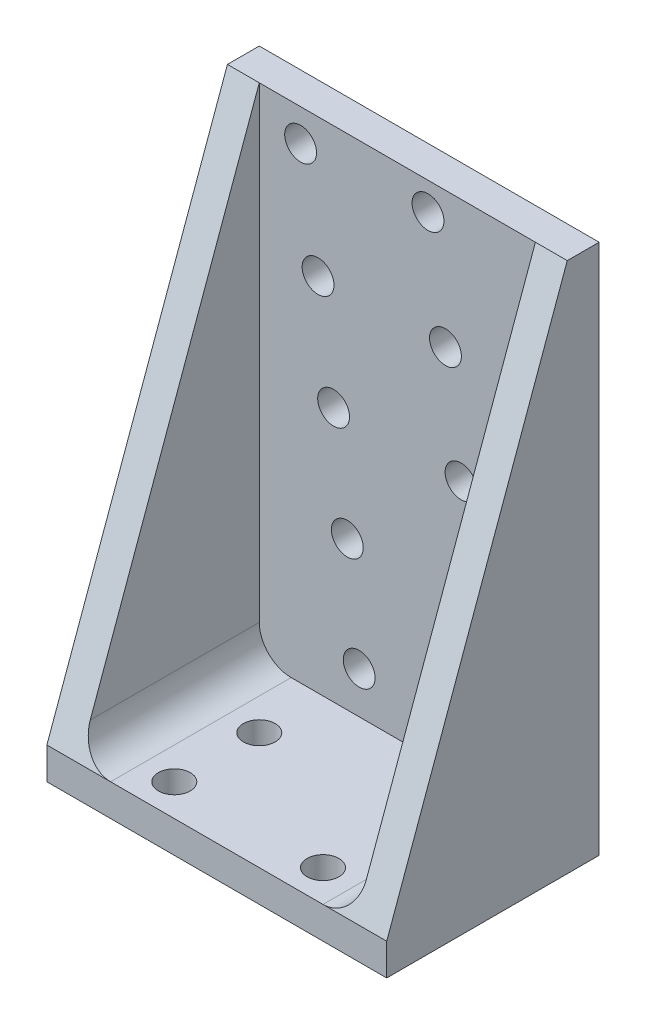
from build123d import *

# Parameters (mm, degrees)
SKETCH_1_W      = 32
SKETCH_1_H      = 50
SKETCH_1_R      = 1.5
EXTRUDE_1_DEPTH = 3
SKETCH_2_W      = 32
SKETCH_2_H      = 20
SKETCH_2_R      = 1.5
EXTRUDE_2_DEPTH = 3
RIB_2_REACH     = 48.4
SKETCH_3_WALL_W = 144.780858064
SKETCH_3_WALL_H = 3
FILLET_1_R      = 3


with BuildPart() as part:
    # 草图1 → 凸台-拉伸1 (new body)
    with BuildSketch(Plane.XY):
        with Locations((0, -2)):
            Rectangle(SKETCH_1_W, SKETCH_1_H)
        with Locations((-6, 0)):
            Circle(SKETCH_1_R, mode=Mode.SUBTRACT)
        with Locations(Location((6, 0, 0), (0, 0, 180))):
            Circle(SKETCH_1_R, mode=Mode.SUBTRACT)
        with Locations((-4.708682872, -10.029713378)):
            Circle(SKETCH_1_R, mode=Mode.SUBTRACT)
        with Locations(Location((7.28948947, -10.239142255, 0), (0, 0, 180))):
            Circle(SKETCH_1_R, mode=Mode.SUBTRACT)
        with Locations((-3.592605052, -20.080435773)):
            Circle(SKETCH_1_R, mode=Mode.SUBTRACT)
        with Locations(Location((8.400084873, -20.499229733, 0), (0, 0, 180))):
            Circle(SKETCH_1_R, mode=Mode.SUBTRACT)
        with Locations((-7.466163089, 10.005649212)):
            Circle(SKETCH_1_R, mode=Mode.SUBTRACT)
        with Locations(Location((4.532009253, 10.21507809, 0), (0, 0, 180))):
            Circle(SKETCH_1_R, mode=Mode.SUBTRACT)
        with Locations((-9.106725531, 19.984186442)):
            Circle(SKETCH_1_R, mode=Mode.SUBTRACT)
        with Locations(Location((2.885964394, 20.402980402, 0), (0, 0, 180))):
            Circle(SKETCH_1_R, mode=Mode.SUBTRACT)
    extrude(amount=EXTRUDE_1_DEPTH)

    # 草图2 → 凸台-拉伸2 (add)
    with BuildSketch(Plane.XZ.offset(27)):
        with Locations((0, 10)):
            Rectangle(SKETCH_2_W, SKETCH_2_H)
        with Locations(Location((7, 9, 0), (0, 0, 270))):
            Circle(SKETCH_2_R, mode=Mode.SUBTRACT)
        with Locations(Location((7, 17, 0), (0, 0, 270))):
            Circle(SKETCH_2_R, mode=Mode.SUBTRACT)
        with Locations(Location((-7, 17, 0), (0, 0, 90))):
            Circle(SKETCH_2_R, mode=Mode.SUBTRACT)
        with Locations(Location((-7, 9, 0), (0, 0, 90))):
            Circle(SKETCH_2_R, mode=Mode.SUBTRACT)
    extrude(amount=-EXTRUDE_2_DEPTH)

    # 草图3 wall → 筋2 (add, up to next)
    with BuildSketch(Plane(origin=(16, -0.5, 11.5), x_dir=(0, -0.940376225751, 0.340136081654), z_dir=(0, -0.340136081654, -0.940376225751)), mode=Mode.PRIVATE) as rib_2_sk1:
        with Locations((0, 1.5)):
            Rectangle(SKETCH_3_WALL_W, SKETCH_3_WALL_H)
    rib_2_tool1 = extrude(rib_2_sk1.sketch, amount=RIB_2_REACH, mode=Mode.PRIVATE) - part.part
    rib_2 = rib_2_tool1.solids().sort_by_distance((16, -0.5, 11.5))[0]
    add(rib_2)

    # 镜向1: 筋2 across plane
    add(rib_2.mirror(Plane(origin=(0, 0, 0), x_dir=(0, 0, 1), z_dir=(1, 0, 0))))

    # 圆角1
    fillet_1_edges = [part.edges().sort_by_distance(p)[0] for p in [
        (-13, -24, 11.5),
        (13, -24, 11.5),
    ]]
    fillet(fillet_1_edges, radius=FILLET_1_R)


solid = part.part
